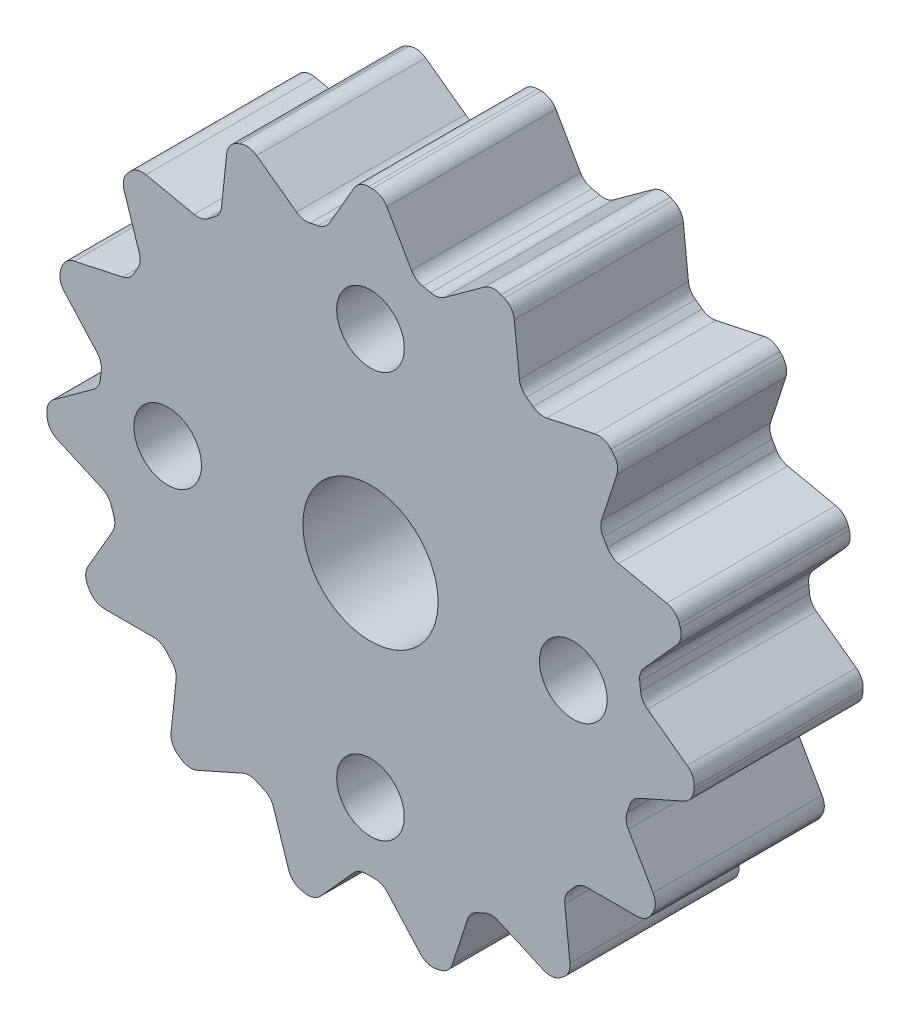
from build123d import *

# Parameters (mm, degrees)
BOSS_EXTRUDE1_DEPTH      = 3.175
SKETCH6_R                = 5.093270322110958
BOSS_EXTRUDE2_DEPTH      = 3.175
FILLET1_R                = 0.3175
CIRPATTERN3_COUNT        = 15
FILLET1_OF_CIRPATTERN3_R = 0.3175
SKETCH7_R                = 1.27
SKETCH7_R_2              = 0.635
SKETCH7_R_3              = 0.6350000000000001
CUT_EXTRUDE1_DEPTH       = 3.175


with BuildPart() as part:
    # Sketch1 → Boss-Extrude1 (new body)
    with BuildSketch(Plane.XY):
        with BuildLine():
            Line((0.21589999999999998, 6.109270322110954), (-0.21589999999999998, 6.109270322110954))
            Line((-0.21589999999999998, 6.109270322110954), (-0.8430504444620047, 5.023013888313339))
            ThreePointArc((-0.8430504444620047, 5.023013888313339), (-0.9512218419347573, 5.003656621064491), (-1.0589504444620048, 4.981970145461529))
            ThreePointArc((-1.0589504444620048, 4.981970145461529), (-1.7e-16, 4.028486882556943), (1.0589504444620048, 4.981970145461529))
            ThreePointArc((1.0589504444620048, 4.981970145461529), (0.9512218419347568, 5.003656621064491), (0.8430504444620047, 5.023013888313339))
            Line((0.8430504444620047, 5.023013888313339), (0.21589999999999998, 6.109270322110954))
        make_face()
    boss_extrude1 = extrude(amount=BOSS_EXTRUDE1_DEPTH)

    # Sketch6 → Boss-Extrude2 (add)
    with BuildSketch(Plane.XY):
        Circle(SKETCH6_R)
    extrude(amount=BOSS_EXTRUDE2_DEPTH)

    # Fillet1
    fillet1_edges = [part.edges().sort_by_distance(p)[0] for p in [
        (-0.8430504444620048, 5.02301388831334, 1.5875),
        (-0.21589999999999998, 6.109270322110954, 1.5875),
        (0.21589999999999998, 6.109270322110954, 1.5875),
        (0.8430504444620048, 5.02301388831334, 1.5875),
    ]]
    fillet(fillet1_edges, radius=FILLET1_R)

    # CirPattern3: Boss-Extrude1 ×15 about axis
    cirpattern3_axis = Axis((0, -7e-17, 0), (0, 0, 1))
    for i in range(1, CIRPATTERN3_COUNT):
        add(boss_extrude1.rotate(cirpattern3_axis, i * 360 / CIRPATTERN3_COUNT))

    # Fillet1 of CirPattern3
    fillet1_of_cirpattern3_edges = [part.edges().sort_by_distance(p)[0] for p in [
        (-2.8132087111575306, 4.245852013620313, 1.5875),
        (-2.6820985667630595, 5.493281711035146, 1.5875),
        (-2.2876296381529846, 5.668910593515277, 1.5875),
        (-1.2728789029538499, 4.931651029068387, 1.5875),
        (-4.2969376344951105, 2.734543753417715, 1.5875),
        (-4.684537925232247, 3.92745478722371, 1.5875),
        (-4.3956073294064915, 4.248344722864849, 1.5875),
        (-3.168715924307178, 3.9875609042544276, 1.5875),
        (-5.037687004375571, 0.7504080356990912, 1.5875),
        (-5.876978118737766, 1.6825352508946705, 1.5875),
        (-5.743544580566663, 2.093201454630918, 1.5875),
        (-4.516653175467346, 2.353985273241322, 1.5875),
        (-4.907374525249817, -1.3634800486348928, 1.5875),
        (-6.053235404843441, -0.8533099156669512, 1.5875),
        (-6.098370795282413, -0.42387536124693076, 1.5875),
        (-5.083620060083269, 0.3133842031999436, 1.5875),
        (-3.928532408610401, -3.2416100457325268, 1.5875),
        (-5.182833297534428, -3.241610045732536, 1.5875),
        (-5.398733297534427, -2.8676602763784156, 1.5875),
        (-4.771582853072406, -1.7814038425808105, 1.5875),
        (-2.270411348925739, -4.559236216820256, 1.5875),
        (-3.4162722285193556, -5.069406349788216, 1.5875),
        (-3.7656057666904577, -4.815600677848326, 1.5875),
        (-3.634495622295968, -3.5681709804334942, 1.5875),
        (-0.21971554097223567, -5.088529026659036, 1.5875),
        (-1.059006655334417, -6.0206562418546286, 1.5875),
        (-1.4813707893312742, -5.930879973759519, 1.5875),
        (-1.8689710800683925, -4.737968939953519, 1.5875),
        (1.8689710800683934, -4.737968939953517, 1.5875),
        (1.4813707893312753, -5.930879973759519, 1.5875),
        (1.0590066553344182, -6.0206562418546286, 1.5875),
        (0.21971554097223658, -5.088529026659036, 1.5875),
        (3.6344956222959675, -3.5681709804334965, 1.5874999999999997),
        (3.7656057666904563, -4.815600677848327, 1.5874999999999997),
        (3.4162722285193543, -5.069406349788217, 1.5874999999999997),
        (2.270411348925738, -4.559236216820258, 1.5874999999999997),
        (4.771582853072404, -1.781403842580814, 1.5875),
        (5.398733297534425, -2.8676602763784196, 1.5875),
        (5.182833297534425, -3.24161004573254, 1.5875),
        (3.928532408610399, -3.2416100457325303, 1.5875),
        (5.083620060083269, 0.3133842031999447, 1.5875),
        (6.098370795282414, -0.42387536124692954, 1.5875),
        (6.053235404843442, -0.85330991566695, 1.5875),
        (4.907374525249819, -1.363480048634892, 1.5875),
        (4.516653175467346, 2.3539852732413205, 1.5875),
        (5.743544580566664, 2.0932014546309166, 1.5875),
        (5.8769781187377665, 1.6825352508946692, 1.5875),
        (5.037687004375571, 0.7504080356990901, 1.5875),
        (3.1687159243071803, 3.9875609042544253, 1.5875),
        (4.395607329406493, 4.2483447228648465, 1.5875),
        (4.684537925232249, 3.9274547872237076, 1.5875),
        (4.296937634495112, 2.7345437534177126, 1.5875),
        (1.2728789029538499, 4.931651029068388, 1.5875),
        (2.2876296381529846, 5.668910593515278, 1.5875),
        (2.6820985667630595, 5.493281711035147, 1.5875),
        (2.8132087111575306, 4.245852013620314, 1.5875),
    ]]
    fillet(fillet1_of_cirpattern3_edges, radius=FILLET1_OF_CIRPATTERN3_R)

    # Sketch7 → Cut-Extrude1 (cut)
    with BuildSketch(Plane.XY.offset(3.175)):
        Circle(SKETCH7_R)
        with Locations((0, 3.8099999999999996)):
            Circle(SKETCH7_R_2)
        with Locations((-3.8099999999999996, 0)):
            Circle(SKETCH7_R_3)
        with Locations(Location((3.8099999999999996, 0, 0), (0, 0, 180))):
            Circle(SKETCH7_R_3)
        with Locations(Location((-1.73e-15, -3.8099999999999996, 0), (0, 0, 180))):
            Circle(SKETCH7_R_2)
    extrude(amount=-CUT_EXTRUDE1_DEPTH, mode=Mode.SUBTRACT)


solid = part.part
